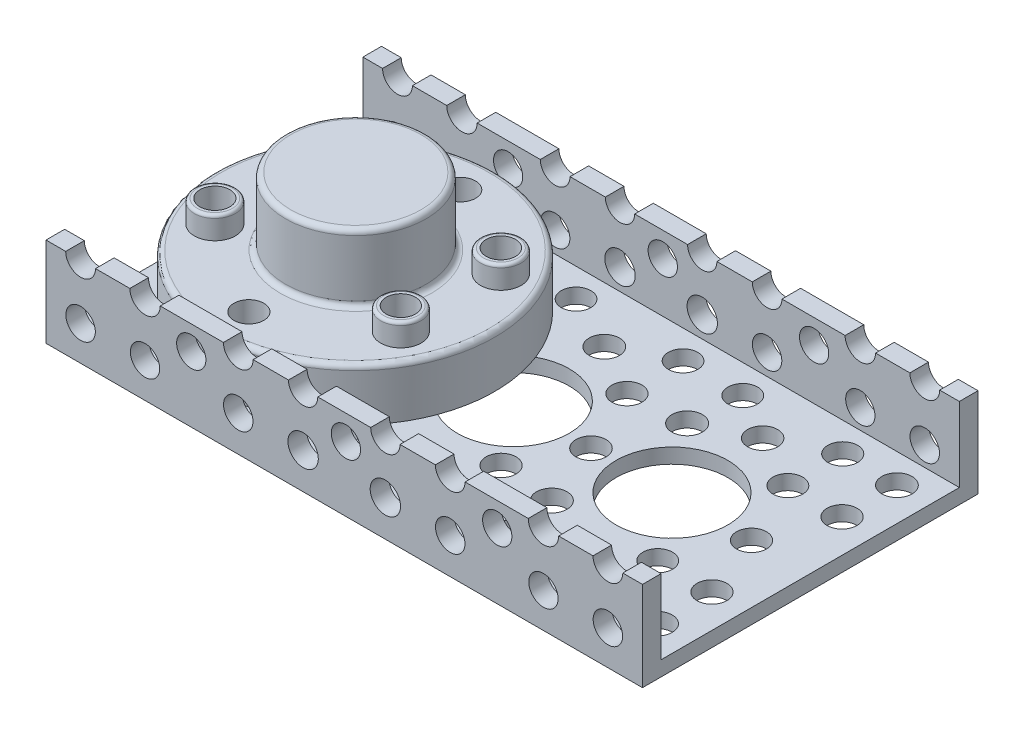
from build123d import *

# Parameters (mm, degrees)
SKETCH1_W           = 80
SKETCH1_H           = 45
BOSS_EXTRUDE1_DEPTH = 2
SKETCH2_W           = 80
SKETCH2_H           = 2.5
BOSS_EXTRUDE2_DEPTH = 10
SKETCH3_R           = 7.5
CUT_EXTRUDE1_DEPTH  = 4
SKETCH4_R           = 2
SKETCH4_R_2         = 1.98406221
SKETCH4_R_3         = 2.019414366
SKETCH4_R_4         = 2.007064973
CUT_EXTRUDE2_DEPTH  = 4
SKETCH5_R           = 2.028890381
SKETCH5_R_2         = 1.999099078
SKETCH5_R_3         = 2.009789523
SKETCH5_R_4         = 1.987812234
CUT_EXTRUDE3_DEPTH  = 4
SKETCH6_R           = 1.985900763
SKETCH6_R_2         = 1.981542083
SKETCH6_R_3         = 2.044583874
SKETCH6_R_4         = 2.005995758
CUT_EXTRUDE4_DEPTH  = 4
SKETCH7_R           = 2.016703509
SKETCH7_R_2         = 2.032414693
SKETCH7_R_3         = 2.014284329
SKETCH7_R_4         = 1.953803629
SKETCH7_R_5         = 2.044632909
SKETCH7_R_6         = 2.037793618
CUT_EXTRUDE5_DEPTH  = 4
SKETCH8_R           = 1.962003794
SKETCH8_R_2         = 1.977544819
SKETCH8_R_3         = 1.966364127
SKETCH8_R_4         = 1.973663167
SKETCH8_R_5         = 2.036136169
CUT_EXTRUDE6_DEPTH  = 47
SKETCH9_R           = 1.964093583
CUT_EXTRUDE7_DEPTH  = 47
SKETCH10_R          = 18.746230229
BOSS_EXTRUDE3_DEPTH = 7
SKETCH11_R          = 9.436763278
BOSS_EXTRUDE4_DEPTH = 9
FILLET1_R           = 0.7
SKETCH12_R          = 2.02139759
SKETCH12_R_2        = 2.001530793
CUT_EXTRUDE8_DEPTH  = 5
SKETCH13_R          = 2.725910946
SKETCH13_R_2        = 1.975910946
SKETCH13_R_3        = 2.759003865
SKETCH13_R_4        = 2.009003865
SKETCH13_R_5        = 2.753526337
SKETCH13_R_6        = 2.003526337
SKETCH13_R_7        = 2.710684074
SKETCH13_R_8        = 1.960684074
BOSS_EXTRUDE5_DEPTH = 3
FILLET2_R           = 0.4


with BuildPart() as part:
    # Sketch1 → Boss-Extrude1 (new body)
    with BuildSketch(Plane(origin=(0, 0, 0), x_dir=(1, 0, 0), z_dir=(0, 1, 0))):
        with Locations((-16.063829787, -4.255319149)):
            Rectangle(SKETCH1_W, SKETCH1_H)
    extrude(amount=BOSS_EXTRUDE1_DEPTH)

    # Sketch2 → Boss-Extrude2 (add)
    with BuildSketch(Plane(origin=(0, 2, 0), x_dir=(1, 0, 0), z_dir=(0, 1, 0))):
        with Locations((-16.063829787, 16.994680851)):
            Rectangle(SKETCH2_W, SKETCH2_H)
        with Locations((-16.063829787, -25.505319149)):
            Rectangle(SKETCH2_W, SKETCH2_H)
    extrude(amount=BOSS_EXTRUDE2_DEPTH)

    # Sketch3 → Cut-Extrude1 (cut)
    with BuildSketch(Plane(origin=(0, 2, 0), x_dir=(1, 0, 0), z_dir=(0, 1, 0))):
        with Locations(Location((-37.117411712, -4.255319149, 0), (0, 0, 270))):
            Circle(SKETCH3_R)
        with BuildLine():
            ThreePointArc((-8.519130038, -4.121219901), (-10.731656545, 1.197861228), (-16.063829787, 3.378646893))
            Line((-16.063829787, 3.378646893), (-16.063829787, -11.621086695))
            ThreePointArc((-16.063829787, -11.621086695), (-10.731656545, -9.44030103), (-8.519130038, -4.121219901))
        make_face()
        with BuildLine():
            Line((-16.063829787, -11.621086695), (-16.063829787, 3.378646893))
            ThreePointArc((-16.063829787, 3.378646893), (-23.519130038, -4.121219901), (-16.063829787, -11.621086695))
        make_face()
        with Locations(Location((5.257950633, -4.121219901, 0), (0, 0, 270))):
            Circle(SKETCH3_R)
    extrude(amount=-CUT_EXTRUDE1_DEPTH, mode=Mode.SUBTRACT)

    # Sketch4 → Cut-Extrude2 (cut)
    with BuildSketch(Plane(origin=(0, 2, 0), x_dir=(1, 0, 0), z_dir=(0, 1, 0))):
        with Locations(Location((-48.101480788, -4.381967663, 0), (0, 0, 270))):
            Circle(SKETCH4_R)
        with Locations(Location((-26.58849855, -4.389714423, 0), (0, 0, 270))):
            Circle(SKETCH4_R_2)
        with Locations(Location((-5.335052075, -4.389714423, 0), (0, 0, 270))):
            Circle(SKETCH4_R_3)
        with Locations(Location((16.133261037, -4.327425654, 0), (0, 0, 270))):
            Circle(SKETCH4_R_4)
    extrude(amount=-CUT_EXTRUDE2_DEPTH, mode=Mode.SUBTRACT)

    # Sketch5 → Cut-Extrude3 (cut)
    with BuildSketch(Plane(origin=(0, 2, 0), x_dir=(1, 0, 0), z_dir=(0, 1, 0))):
        with Locations(Location((-51.603953674, 11.830741793, 0), (0, 0, 270))):
            Circle(SKETCH5_R)
        with Locations(Location((-44.336294486, 11.830741793, 0), (0, 0, 270))):
            Circle(SKETCH5_R_2)
        with Locations(Location((-51.603953674, 4.470500959, 0), (0, 0, 270))):
            Circle(SKETCH5_R_3)
        with Locations(Location((-44.336294486, 4.470500959, 0), (0, 0, 270))):
            Circle(SKETCH5_R_4)
        with Locations(Location((12.208634911, 11.830741793, 0), (0, 0, 270))):
            Circle(SKETCH5_R_2)
        with Locations(Location((19.476294099, 11.830741793, 0), (0, 0, 270))):
            Circle(SKETCH5_R)
        with Locations(Location((12.208634911, 4.470500959, 0), (0, 0, 270))):
            Circle(SKETCH5_R_4)
        with Locations(Location((19.476294099, 4.470500959, 0), (0, 0, 270))):
            Circle(SKETCH5_R_3)
        with Locations(Location((12.208634911, -12.981139257, 0), (0, 0, 270))):
            Circle(SKETCH5_R_4)
        with Locations(Location((19.476294099, -12.981139257, 0), (0, 0, 270))):
            Circle(SKETCH5_R_3)
        with Locations(Location((12.208634911, -20.341380091, 0), (0, 0, 270))):
            Circle(SKETCH5_R_2)
        with Locations(Location((19.476294099, -20.341380091, 0), (0, 0, 270))):
            Circle(SKETCH5_R)
        with Locations(Location((-51.603953674, -12.981139257, 0), (0, 0, 270))):
            Circle(SKETCH5_R_3)
        with Locations(Location((-44.336294486, -12.981139257, 0), (0, 0, 270))):
            Circle(SKETCH5_R_4)
        with Locations(Location((-51.603953674, -20.341380091, 0), (0, 0, 270))):
            Circle(SKETCH5_R)
        with Locations(Location((-44.336294486, -20.341380091, 0), (0, 0, 270))):
            Circle(SKETCH5_R_2)
    extrude(amount=-CUT_EXTRUDE3_DEPTH, mode=Mode.SUBTRACT)

    # Sketch6 → Cut-Extrude4 (cut)
    with BuildSketch(Plane(origin=(0, 2, 0), x_dir=(1, 0, 0), z_dir=(0, 1, 0))):
        with Locations(Location((-31.68746174, 11.90494534, 0), (0, 0, 270))):
            Circle(SKETCH6_R)
        with Locations(Location((-23.65625262, 11.926651614, 0), (0, 0, 270))):
            Circle(SKETCH6_R_2)
        with Locations(Location((-31.185987186, 4.944225944, 0), (0, 0, 270))):
            Circle(SKETCH6_R_3)
        with Locations(Location((-23.699665168, 4.360574267, 0), (0, 0, 270))):
            Circle(SKETCH6_R_4)
        with Locations(Location((-9.303895241, 11.926651614, 0), (0, 0, 270))):
            Circle(SKETCH6_R_2)
        with Locations(Location((-1.272686122, 11.90494534, 0), (0, 0, 270))):
            Circle(SKETCH6_R)
        with Locations(Location((-1.774160675, 4.944225944, 0), (0, 0, 270))):
            Circle(SKETCH6_R_3)
        with Locations(Location((-9.260482693, 4.360574267, 0), (0, 0, 270))):
            Circle(SKETCH6_R_4)
        with Locations(Location((-9.36502981, -12.421471796, 0), (0, 0, 270))):
            Circle(SKETCH6_R_4)
        with Locations(Location((-1.886560514, -13.098349637, 0), (0, 0, 270))):
            Circle(SKETCH6_R_3)
        with Locations(Location((-9.502704119, -19.986421026, 0), (0, 0, 270))):
            Circle(SKETCH6_R_2)
        with Locations(Location((-1.471847907, -20.064776604, 0), (0, 0, 270))):
            Circle(SKETCH6_R)
        with Locations(Location((-23.853947535, -19.807606196, 0), (0, 0, 270))):
            Circle(SKETCH6_R_2)
        with Locations(Location((-23.803091584, -12.241575219, 0), (0, 0, 270))):
            Circle(SKETCH6_R_4)
        with Locations(Location((-31.296104216, -12.73191013, 0), (0, 0, 270))):
            Circle(SKETCH6_R_3)
        with Locations(Location((-31.884262873, -19.685841438, 0), (0, 0, 270))):
            Circle(SKETCH6_R)
    extrude(amount=-CUT_EXTRUDE4_DEPTH, mode=Mode.SUBTRACT)

    # Sketch7 → Cut-Extrude5 (cut)
    with BuildSketch(Plane(origin=(0, 2, 0), x_dir=(1, 0, 0), z_dir=(0, 1, 0))):
        with Locations(Location((-37.940190954, 8.288721316, 0), (0, 0, 270))):
            Circle(SKETCH7_R)
        with Locations(Location((-16.227549333, 8.288721316, 0), (0, 0, 270))):
            Circle(SKETCH7_R_2)
        with Locations(Location((5.009482648, 8.288721316, 0), (0, 0, 270))):
            Circle(SKETCH7_R_3)
        with Locations(Location((5.009482648, -16.481653687, 0), (0, 0, 270))):
            Circle(SKETCH7_R_4)
        with Locations(Location((-16.227549333, -16.481653687, 0), (0, 0, 270))):
            Circle(SKETCH7_R_5)
        with Locations(Location((-37.940190954, -16.481653687, 0), (0, 0, 270))):
            Circle(SKETCH7_R_6)
    extrude(amount=-CUT_EXTRUDE5_DEPTH, mode=Mode.SUBTRACT)

    # Sketch8 → Cut-Extrude6 (cut)
    with BuildSketch(Plane.XY.offset(26.755319149)):
        with BuildLine():
            Line((-53.423030702, 12), (-49.423393656, 12))
            ThreePointArc((-49.423393656, 12), (-51.423212179, 13.999818523), (-53.423030702, 12))
        make_face()
        with BuildLine():
            ThreePointArc((-53.423030702, 12), (-51.423212179, 10.000181477), (-49.423393656, 12))
            Line((-49.423393656, 12), (-53.423030702, 12))
        make_face()
        with BuildLine():
            ThreePointArc((-40.74153253, 12), (-42.780966026, 14.039433496), (-44.820399522, 12))
            Line((-44.820399522, 12), (-40.74153253, 12))
        make_face()
        with BuildLine():
            Line((-40.74153253, 12), (-44.820399522, 12))
            ThreePointArc((-44.820399522, 12), (-42.780966026, 9.960566504), (-40.74153253, 12))
        make_face()
        with BuildLine():
            ThreePointArc((-28.285982758, 12), (-30.278450276, 13.992467518), (-32.270917794, 12))
            Line((-32.270917794, 12), (-28.285982758, 12))
        make_face()
        with BuildLine():
            Line((-28.285982758, 12), (-32.270917794, 12))
            ThreePointArc((-32.270917794, 12), (-30.278450276, 10.007532482), (-28.285982758, 12))
        make_face()
        with BuildLine():
            ThreePointArc((-19.612055674, 12), (-21.578786744, 13.96673107), (-23.545517813, 12))
            Line((-23.545517813, 12), (-19.612055674, 12))
        make_face()
        with BuildLine():
            Line((-19.612055674, 12), (-23.545517813, 12))
            ThreePointArc((-23.545517813, 12), (-21.578786744, 10.03326893), (-19.612055674, 12))
        make_face()
        with BuildLine():
            ThreePointArc((-8.582141761, 12), (-10.548872831, 13.96673107), (-12.5156039, 12))
            Line((-12.5156039, 12), (-8.582141761, 12))
        make_face()
        with BuildLine():
            Line((-8.582141761, 12), (-12.5156039, 12))
            ThreePointArc((-12.5156039, 12), (-10.548872831, 10.03326893), (-8.582141761, 12))
        make_face()
        with BuildLine():
            ThreePointArc((0.143258219, 12), (-1.849209299, 13.992467518), (-3.841676817, 12))
            Line((-3.841676817, 12), (0.143258219, 12))
        make_face()
        with BuildLine():
            Line((0.143258219, 12), (-3.841676817, 12))
            ThreePointArc((-3.841676817, 12), (-1.849209299, 10.007532482), (0.143258219, 12))
        make_face()
        with Locations((4.455849877, 8.788292737)):
            Circle(SKETCH8_R)
        with BuildLine():
            ThreePointArc((12.692739948, 12), (10.653306452, 14.039433496), (8.613872956, 12))
            Line((8.613872956, 12), (12.692739948, 12))
        make_face()
        with BuildLine():
            Line((12.692739948, 12), (8.613872956, 12))
            ThreePointArc((8.613872956, 12), (10.653306452, 9.960566504), (12.692739948, 12))
        make_face()
        with BuildLine():
            ThreePointArc((21.295371128, 12), (19.295552605, 13.999818523), (17.295734082, 12))
            Line((17.295734082, 12), (21.295371128, 12))
        make_face()
        with BuildLine():
            Line((21.295371128, 12), (17.295734082, 12))
            ThreePointArc((17.295734082, 12), (19.295552605, 10.000181477), (21.295371128, 12))
        make_face()
        with Locations((19.295552605, 4.643358638)):
            Circle(SKETCH8_R_2)
        with Locations((10.653306452, 4.665327485)):
            Circle(SKETCH8_R_3)
        with Locations((-1.849209299, 4.797140569)):
            Circle(SKETCH8_R_4)
        with Locations((-10.548872831, 4.841078263)):
            Circle(SKETCH8_R_5)
        with Locations((-30.278450276, 4.797140569)):
            Circle(SKETCH8_R_4)
        with Locations((-21.578786744, 4.841078263)):
            Circle(SKETCH8_R_5)
        with Locations((-36.583509452, 8.788292737)):
            Circle(SKETCH8_R)
        with Locations((-42.780966026, 4.665327485)):
            Circle(SKETCH8_R_3)
        with Locations((-51.423212179, 4.643358638)):
            Circle(SKETCH8_R_2)
    extrude(amount=-CUT_EXTRUDE6_DEPTH, mode=Mode.SUBTRACT)

    # Sketch9 → Cut-Extrude7 (cut)
    with BuildSketch(Plane.XY.offset(26.755319149)):
        with Locations((-15.842314498, 8.703746053)):
            Circle(SKETCH9_R)
    extrude(amount=-CUT_EXTRUDE7_DEPTH, mode=Mode.SUBTRACT)

    # Sketch10 → Boss-Extrude3 (add)
    with BuildSketch(Plane(origin=(0, 2, 0), x_dir=(1, 0, 0), z_dir=(0, 1, 0))):
        with Locations(Location((-37.117411712, -4.255319149, 0), (0, 0, 74.72789498))):
            Circle(SKETCH10_R)
    extrude(amount=BOSS_EXTRUDE3_DEPTH)

    # Sketch11 → Boss-Extrude4 (add)
    with BuildSketch(Plane(origin=(0, 9, 0), x_dir=(1, 0, 0), z_dir=(0, 1, 0))):
        with Locations(Location((-37.162111461, -4.098870026, 0), (0, 0, 270))):
            Circle(SKETCH11_R)
    extrude(amount=BOSS_EXTRUDE4_DEPTH)

    # Fillet1
    fillet1_edges = [part.edges().sort_by_distance(p)[0] for p in [
        (-42.055232773, 9, 22.339540752),
        (-37.162111461, 9, -5.337893251),
        (-37.162111461, 18, -5.337893251),
    ]]
    fillet(fillet1_edges, radius=FILLET1_R)

    # Sketch12 → Cut-Extrude8 (cut)
    with BuildSketch(Plane(origin=(0, 9, 0), x_dir=(1, 0, 0), z_dir=(0, 1, 0))):
        with Locations(Location((-37.117411712, 9.892151507, 0), (0, 0, 270))):
            Circle(SKETCH12_R)
        with Locations(Location((-37.117411712, -18.492189304, 0), (0, 0, 270))):
            Circle(SKETCH12_R_2)
    extrude(amount=-CUT_EXTRUDE8_DEPTH, mode=Mode.SUBTRACT)

    # Sketch13 → Boss-Extrude5 (add)
    # profile 1 of 4: a face of its own
    with BuildSketch(Plane(origin=(0, 9, 0), x_dir=(1, 0, 0), z_dir=(0, 1, 0))):
        with Locations(Location((-24.646181654, 2.829591116, 0), (0, 0, 270))):
            Circle(SKETCH13_R)
        with Locations(Location((-24.646181654, 2.829591116, 0), (0, 0, 270))):
            Circle(SKETCH13_R_2, mode=Mode.SUBTRACT)
    # profile 2 of 4: a face of its own
    with BuildSketch(Plane(origin=(0, 9, 0), x_dir=(1, 0, 0), z_dir=(0, 1, 0))):
        with Locations(Location((-49.588641769, 2.829591116, 0), (0, 0, 270))):
            Circle(SKETCH13_R_3)
        with Locations(Location((-49.588641769, 2.829591116, 0), (0, 0, 270))):
            Circle(SKETCH13_R_4, mode=Mode.SUBTRACT)
    # profile 3 of 4: a face of its own
    with BuildSketch(Plane(origin=(0, 9, 0), x_dir=(1, 0, 0), z_dir=(0, 1, 0))):
        with Locations(Location((-49.588641769, -10.580333676, 0), (0, 0, 270))):
            Circle(SKETCH13_R_5)
        with Locations(Location((-49.588641769, -10.580333676, 0), (0, 0, 270))):
            Circle(SKETCH13_R_6, mode=Mode.SUBTRACT)
    # profile 4 of 4: a face of its own
    with BuildSketch(Plane(origin=(0, 9, 0), x_dir=(1, 0, 0), z_dir=(0, 1, 0))):
        with Locations(Location((-24.646181654, -10.580333676, 0), (0, 0, 270))):
            Circle(SKETCH13_R_7)
        with Locations(Location((-24.646181654, -10.580333676, 0), (0, 0, 270))):
            Circle(SKETCH13_R_8, mode=Mode.SUBTRACT)
    extrude(amount=BOSS_EXTRUDE5_DEPTH)

    # Fillet2
    fillet2_edges = [part.edges().sort_by_distance(p)[0] for p in [
        (-24.646181654, 12, -5.555502063),
        (-49.588641769, 12, -5.588594981),
        (-49.588641769, 12, 7.826807339),
        (-24.646181654, 12, 7.869649602),
    ]]
    fillet(fillet2_edges, radius=FILLET2_R)


solid = part.part
